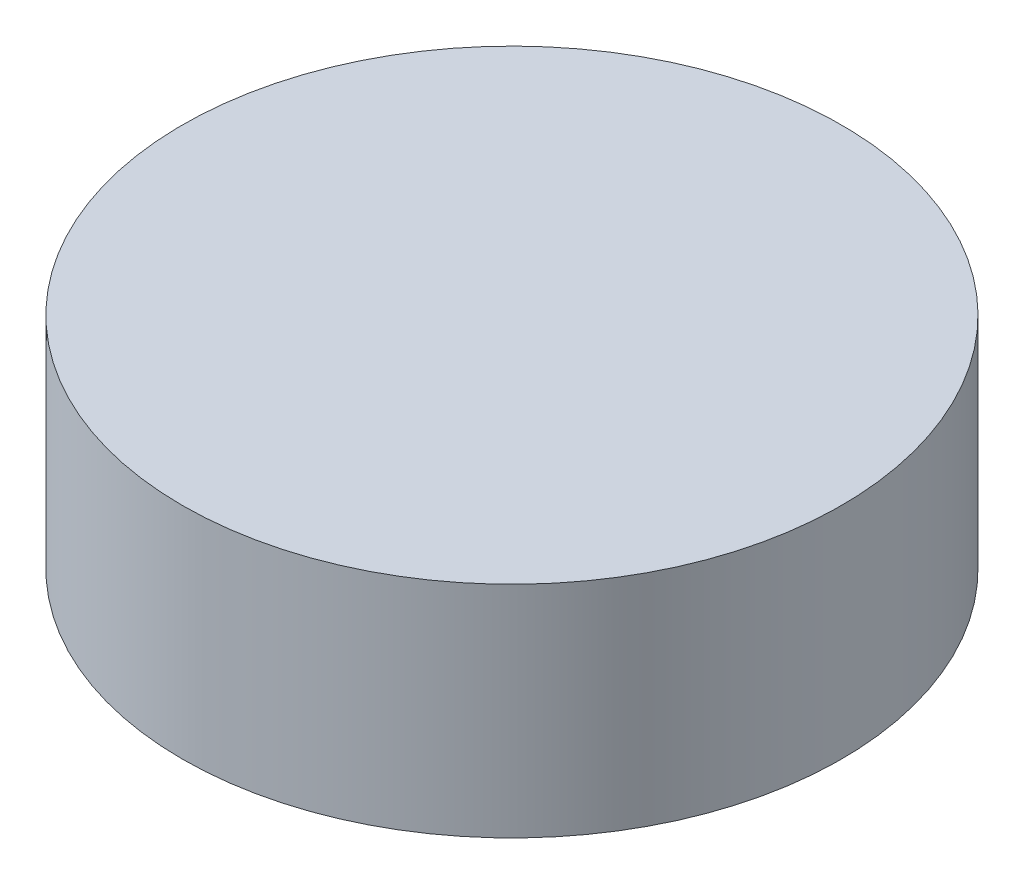
from build123d import *

# Parameters (mm, degrees)
SKETCH2_R           = 7.5
BOSS_EXTRUDE1_DEPTH = 5


with BuildPart() as part:
    # Sketch2 → Boss-Extrude1 (new body)
    with BuildSketch(Plane(origin=(0, 0, 0), x_dir=(1, 0, 0), z_dir=(0, 1, 0))):
        with Locations(Location((0, 0, 0), (0, 0, 270))):
            Circle(SKETCH2_R)
    extrude(amount=BOSS_EXTRUDE1_DEPTH)


solid = part.part
